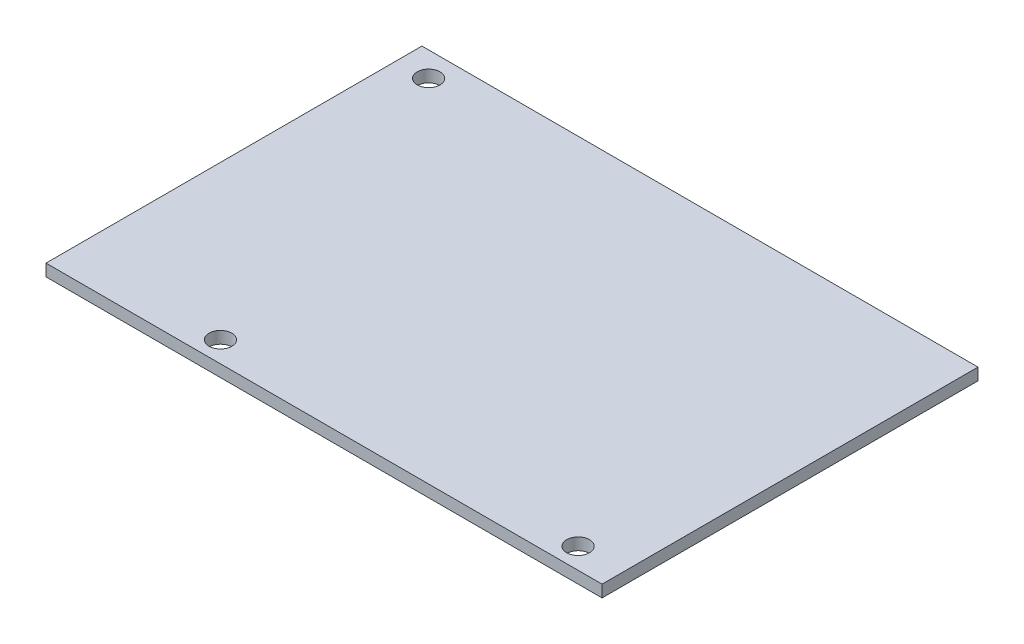
from build123d import *

# Parameters (mm, degrees)
SKETCH1_W           = 74.4
SKETCH1_H           = 50.3
BOSS_EXTRUDE1_DEPTH = 1.6
SKETCH3_R           = 1.524
CUT_EXTRUDE1_DEPTH  = 1.6


with BuildPart() as part:
    # Sketch1 → Boss-Extrude1 (new body)
    with BuildSketch(Plane(origin=(0, 0, 0), x_dir=(1, 0, 0), z_dir=(0, 1, 0))):
        with Locations((37.2, 25.15)):
            Rectangle(SKETCH1_W, SKETCH1_H)
    extrude(amount=BOSS_EXTRUDE1_DEPTH)

    # Sketch3 → Cut-Extrude1 (cut)
    with BuildSketch(Plane(origin=(0, 1.6, 0), x_dir=(1, 0, 0), z_dir=(0, 1, 0))):
        with Locations(Location((20.5486, 2.794, 0), (0, 0, 270))):
            Circle(SKETCH3_R)
        with Locations(Location((68.4022, 2.794, 0), (0, 0, 270))):
            Circle(SKETCH3_R)
        with Locations(Location((4.191, 46.998, 0), (0, 0, 270))):
            Circle(SKETCH3_R)
    extrude(amount=-CUT_EXTRUDE1_DEPTH, mode=Mode.SUBTRACT)


solid = part.part
